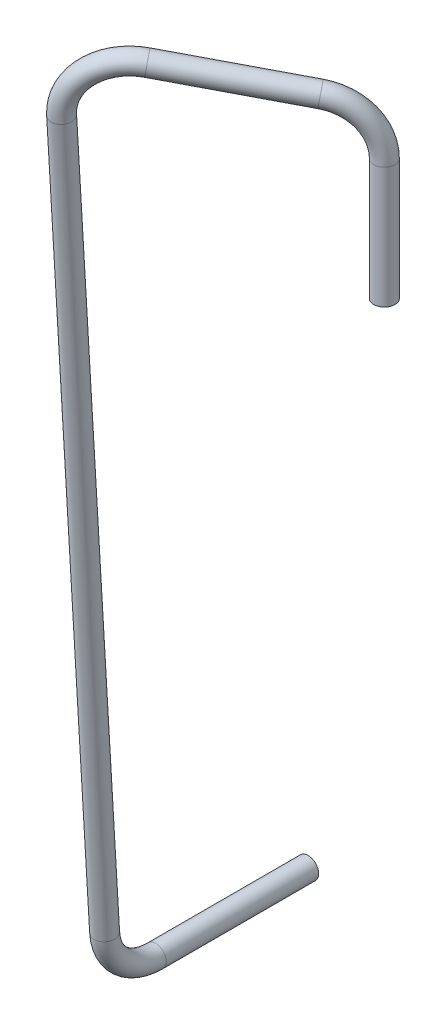
from build123d import *

# Parameters (mm, degrees)
SWEEP_SOTTILE2_PROFILE_R   = 1.585
SWEEP_SOTTILE2_PROFILE_R_2 = 0.585


with BuildPart() as part:
    # Sweep-Sottile2: sweep along a curve in space
    with BuildLine() as sweep_sottile2_path:
        Line((0, 0, 0), (0, 18.127410745, 0))
        ThreePointArc((0, 18.127410745, 0), (-1.490951839, 23.340492786, 1.228284678), (-5.243774412, 26.035994644, 4.319956954))
        Line((-5.243774412, 26.035994644, 4.319956954), (-19.449428273, 28.842557275, 16.022941934))
        ThreePointArc((-19.449428273, 28.842557275, 16.022941934), (-24.665337869, 26.943364665, 19.918970251), (-27.191531065, 20.758738002, 21.08534203))
        Line((-27.191531065, 20.758738002, 21.08534203), (-32.310949634, -93.456386342, 9.532293275))
        ThreePointArc((-32.310949634, -93.456386342, 9.532293275), (-32.540663603, -98.581345189, 6.937785997), (-32.633155846, -100.64486334, 1.57282768))
        Line((-32.633155846, -100.64486334, 1.57282768), (-32.633155846, -100.64486334, -21.222828084))
    # Sweep-Sottile2 profile (on start of the path) → Sweep-Sottile2 (sweep)
    with BuildSketch(Plane.ZX):
        Circle(SWEEP_SOTTILE2_PROFILE_R)
        Circle(SWEEP_SOTTILE2_PROFILE_R_2, mode=Mode.SUBTRACT)
    sweep(path=sweep_sottile2_path.line)


solid = part.part
